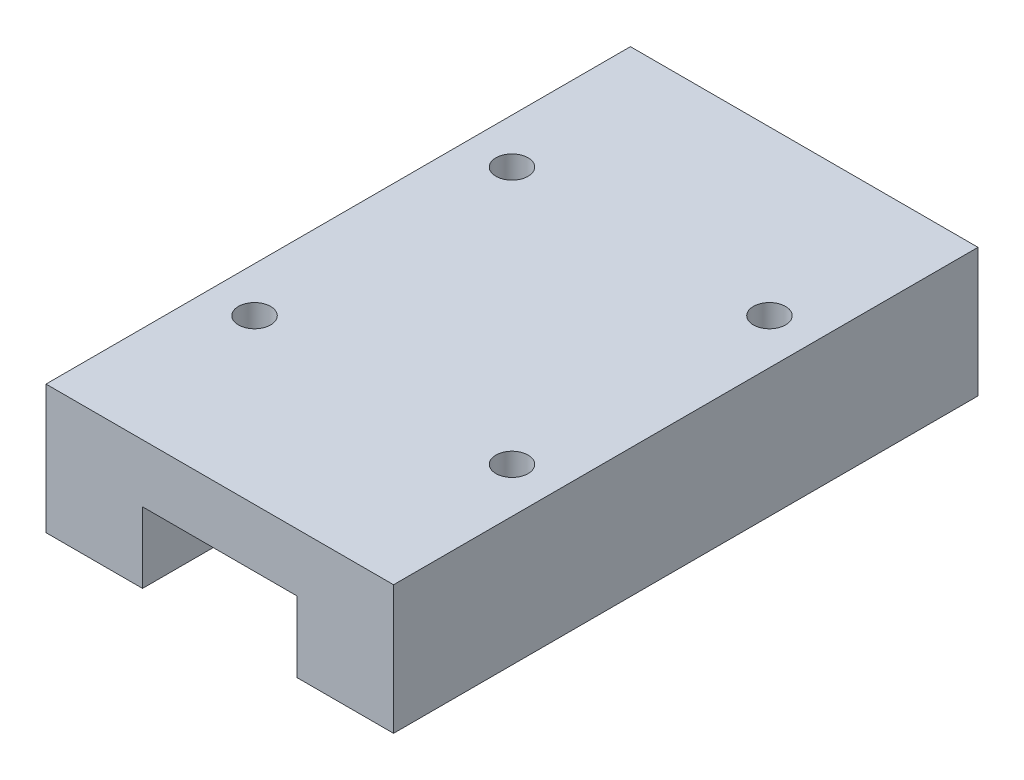
from build123d import *

# Parameters (mm, degrees)
BOSS_EXTRUDE1_DEPTH = 22.7
SKETCH2_R           = 1.25
CUT_EXTRUDE1_DEPTH  = 3.5


with BuildPart() as part:
    # Sketch1 → Boss-Extrude1 (new, symmetric)
    with BuildSketch(Plane.XY):
        Polygon((-13.5, 2.506896552), (-6, 2.506896552), (-6, 8), (6, 8), (6, 2.506896552), (13.5, 2.506896552), (13.5, 12.506896552), (-13.5, 12.506896552), align=None)
    extrude(amount=BOSS_EXTRUDE1_DEPTH, both=True)

    # Sketch2 → Cut-Extrude1 (cut)
    with BuildSketch(Plane(origin=(0, 12.506896552, 0), x_dir=(1, 0, 0), z_dir=(0, 1, 0))):
        with Locations(Location((-10, 10, 0), (0, 0, 180))):
            Circle(SKETCH2_R)
        with Locations(Location((10, 10, 0), (0, 0, 180))):
            Circle(SKETCH2_R)
        with Locations(Location((-10, -10, 0), (0, 0, 180))):
            Circle(SKETCH2_R)
        with Locations(Location((10, -10, 0), (0, 0, 180))):
            Circle(SKETCH2_R)
    extrude(amount=-CUT_EXTRUDE1_DEPTH, mode=Mode.SUBTRACT)


solid = part.part
